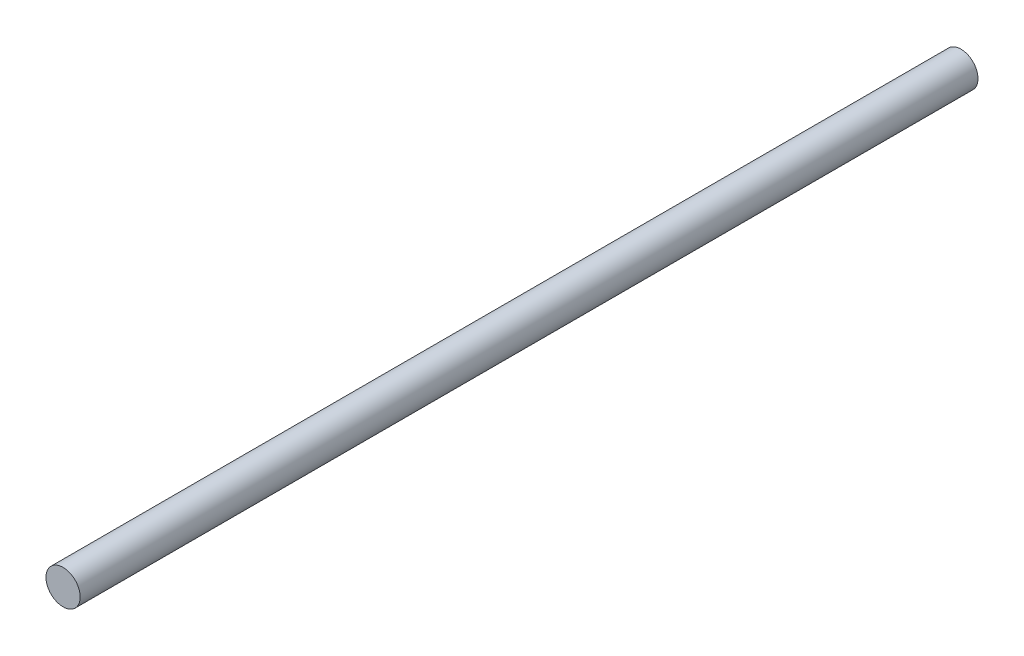
from build123d import *

# Parameters (mm, degrees)
BOSS_EXTRUDE1_DEPTH      = 363.2
BOSS_EXTRUDE1_DEPTH_BACK = 103.2
SKETCH1_R                = 8.89


with BuildPart() as part:
    # Sketch1 → Boss-Extrude1 (new, two sides: drawn at the far end of the back side and taken through both)
    with BuildSketch(Plane.XY.offset(-BOSS_EXTRUDE1_DEPTH_BACK)):
        Circle(SKETCH1_R)
    extrude(amount=BOSS_EXTRUDE1_DEPTH + BOSS_EXTRUDE1_DEPTH_BACK)


solid = part.part
